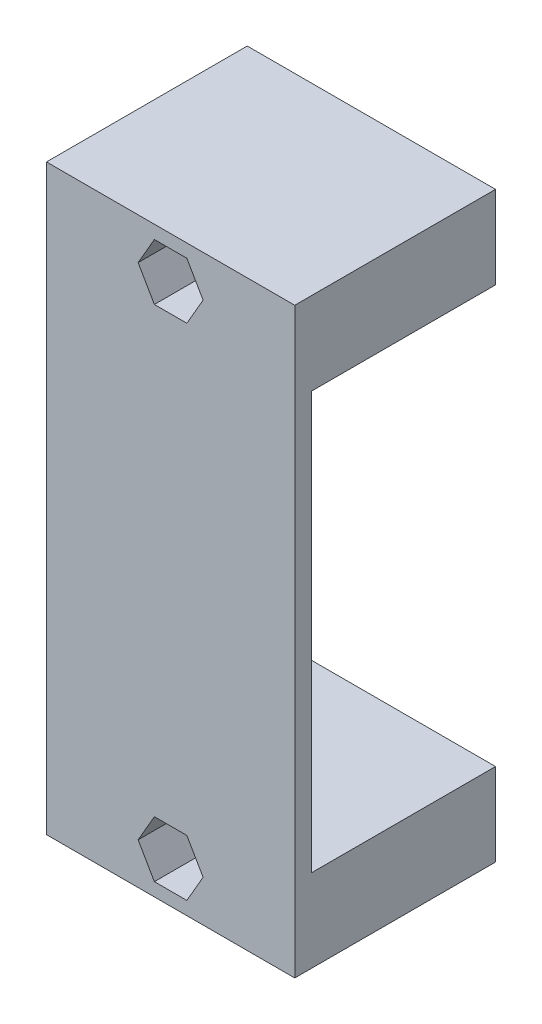
from build123d import *

# Parameters (mm, degrees)
SKETCH2_W           = 30
SKETCH2_H           = 70.4
SKETCH2_R           = 2
BOSS_EXTRUDE1_DEPTH = 2
BOSS_EXTRUDE2_START = -22.26
SKETCH2_2_W         = 30
SKETCH2_2_H         = 10
SKETCH2_2_R         = 2
BOSS_EXTRUDE2_DEPTH = 22.26
CUT_EXTRUDE1_DEPTH  = 14


with BuildPart() as part:
    # Sketch2 → Boss-Extrude1 (new body)
    with BuildSketch(Plane.XY):
        with Locations((-22.5, 3.2)):
            Rectangle(SKETCH2_W, SKETCH2_H)
        with Locations((-22.5, -27)):
            Circle(SKETCH2_R, mode=Mode.SUBTRACT)
        with Locations((-22.5, 33.4)):
            Circle(SKETCH2_R, mode=Mode.SUBTRACT)
    extrude(amount=BOSS_EXTRUDE1_DEPTH)

    # Sketch2<2> → Boss-Extrude2 (add)
    # profile 1 of 2: a face of its own
    with BuildSketch(Plane.XY.offset(BOSS_EXTRUDE2_START)):
        with Locations((-22.5, -27)):
            Rectangle(SKETCH2_2_W, SKETCH2_2_H)
        with Locations(Location((-22.5, -27, 0), (0, 0, 270))):
            Circle(SKETCH2_2_R, mode=Mode.SUBTRACT)
    # profile 2 of 2: a face of its own
    with BuildSketch(Plane.XY.offset(BOSS_EXTRUDE2_START)):
        with Locations((-22.5, 33.4)):
            Rectangle(SKETCH2_2_W, SKETCH2_2_H)
        with Locations(Location((-22.5, 33.4, 0), (0, 0, 270))):
            Circle(SKETCH2_2_R, mode=Mode.SUBTRACT)
    extrude(amount=BOSS_EXTRUDE2_DEPTH)

    # Sketch3 → Cut-Extrude1 (cut)
    with BuildSketch(Plane.XY.offset(2)):
        Polygon((-24.462990915, 30), (-20.537009085, 30), (-18.57401817, 33.4), (-20.537009085, 36.8), (-24.462990915, 36.8), (-26.42598183, 33.4), align=None)
        Polygon((-20.537009085, -30.4), (-18.57401817, -27), (-20.537009085, -23.6), (-24.462990915, -23.6), (-26.42598183, -27), (-24.462990915, -30.4), align=None)
    extrude(amount=-CUT_EXTRUDE1_DEPTH, mode=Mode.SUBTRACT)


solid = part.part
